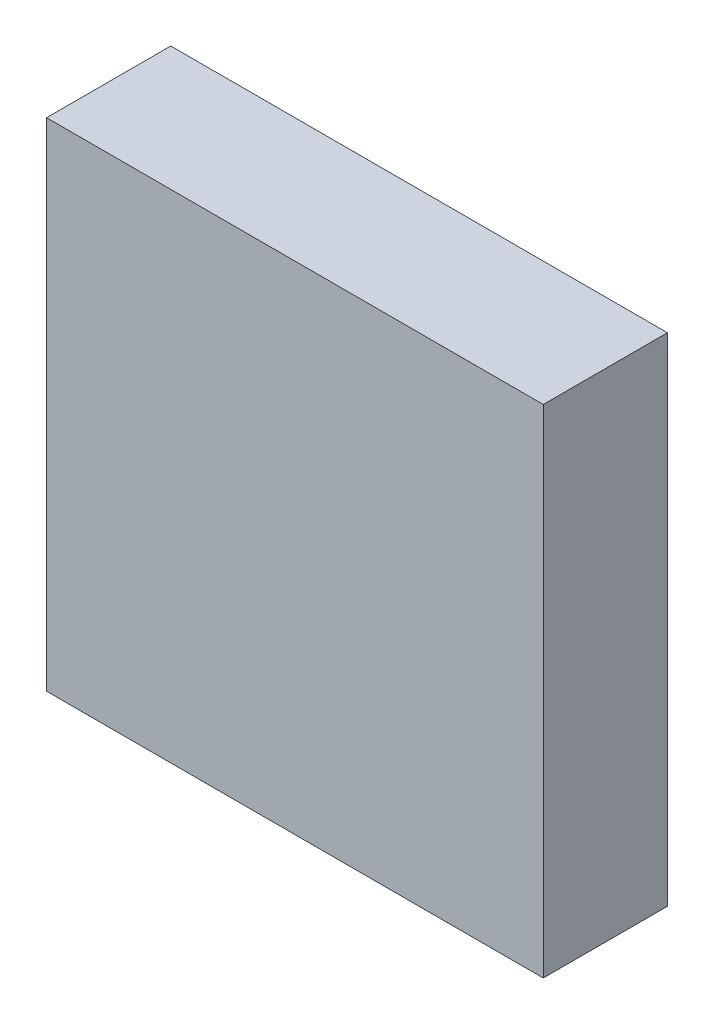
from build123d import *

# Parameters (mm, degrees)
SKETCH2_W           = 2000
SKETCH2_H           = 2000
BOSS_EXTRUDE1_DEPTH = 500


with BuildPart() as part:
    # Sketch2 → Boss-Extrude1 (new body)
    with BuildSketch(Plane.XY):
        Rectangle(SKETCH2_W, SKETCH2_H)
    extrude(amount=BOSS_EXTRUDE1_DEPTH)


solid = part.part
